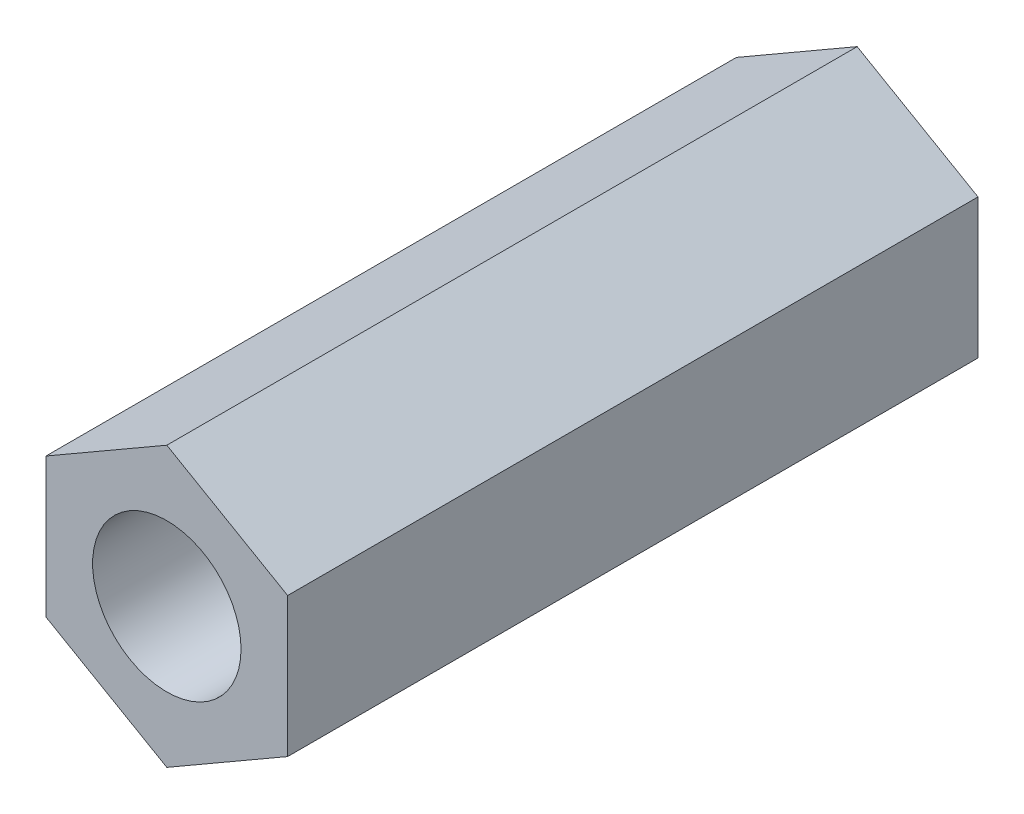
from build123d import *

# Parameters (mm, degrees)
SKETCH_1_R      = 2.15
EXTRUDE_1_DEPTH = 20


with BuildPart() as part:
    # 草图1 → 凸台-拉伸1 (new body)
    with BuildSketch(Plane.XY):
        Polygon((3.5, -2.020725942), (3.5, 2.020725942), (0, 4.041451884), (-3.5, 2.020725942), (-3.5, -2.020725942), (0, -4.041451884), align=None)
        Circle(SKETCH_1_R, mode=Mode.SUBTRACT)
    extrude(amount=EXTRUDE_1_DEPTH)


solid = part.part
